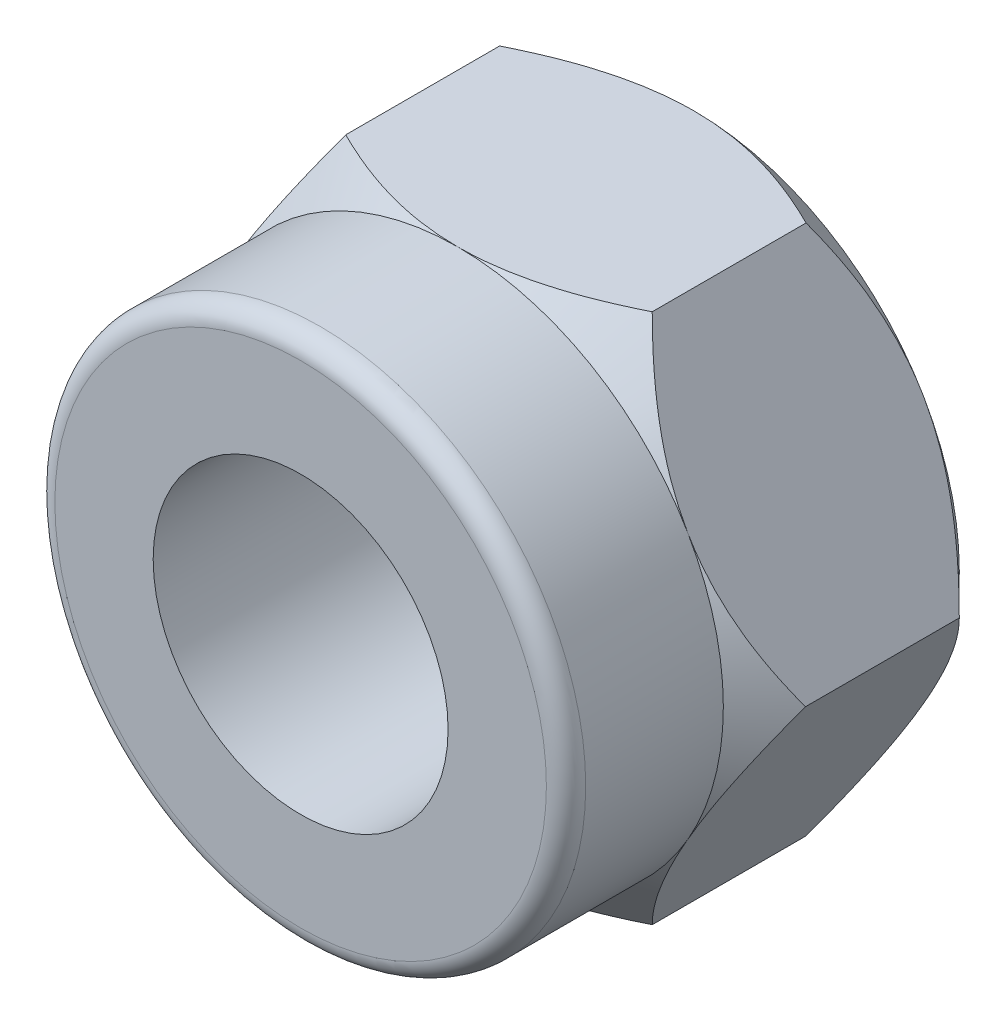
from build123d import *

# Parameters (mm, degrees)
EXTRUDE_1_DEPTH     = 2.4
SKETCH_2_OUTSIDE_W  = 17.954
SKETCH_2_OUTSIDE_H  = 17.118
SKETCH_2_OUTSIDE_R  = 2.7
CUT_EXTRUDE_1_DEPTH = 4
CUT_EXTRUDE_1_DRAFT = -45
SKETCH_3_OUTSIDE_W  = 17.954
SKETCH_3_OUTSIDE_H  = 17.118
SKETCH_3_OUTSIDE_R  = 2.7
CUT_EXTRUDE_2_DEPTH = 4
CUT_EXTRUDE_2_DRAFT = -45
SKETCH_3_2_R        = 2.7
EXTRUDE_2_DEPTH     = 1.6
FILLET_1_R          = 0.2
SKETCH_4_R          = 1.5
CUT_EXTRUDE_3_DEPTH = 6.745432969


with BuildPart() as part:
    # 草图1 → 凸台-拉伸1 (new body)
    with BuildSketch(Plane.XY):
        Polygon((-1.558845727, 2.7), (1.558845727, 2.7), (3.117691454, 0), (1.558845727, -2.7), (-1.558845727, -2.7), (-3.117691454, 0), align=None)
    extrude(amount=EXTRUDE_1_DEPTH)


with BuildPart() as cut_extrude_1_tool:
    # 草图2 outside → 切除-拉伸1 (with draft: the straight prism first)
    with BuildSketch(Plane(origin=(0, 0, 0), x_dir=(-1, 0, 0), z_dir=(0, 0, -1))):
        Rectangle(SKETCH_2_OUTSIDE_W, SKETCH_2_OUTSIDE_H)
        Circle(SKETCH_2_OUTSIDE_R, mode=Mode.SUBTRACT)
    extrude(amount=-CUT_EXTRUDE_1_DEPTH)
    # 切除-拉伸1: the draft: its side faces are tilted about the plane it starts from
    cut_extrude_1_sides = [cut_extrude_1_tool.faces().sort_by_distance(p)[0] for p in [
        (0, -8.559, 2),
        (-8.977, 0, 2),
        (0, 8.559, 2),
        (8.977, 0, 2),
        (2.7, 0, 2),
    ]]
    draft(cut_extrude_1_sides, Plane(origin=(0, 0, 0), x_dir=(-1, 0, 0), z_dir=(0, 0, -1)), CUT_EXTRUDE_1_DRAFT)


with BuildPart() as part_1:
    add(part.part)

    # 切除-拉伸1: cut by cut_extrude_1_tool
    add(cut_extrude_1_tool.part, mode=Mode.SUBTRACT)


with BuildPart() as cut_extrude_2_tool:
    # 草图3 outside → 切除-拉伸2 (with draft: the straight prism first)
    with BuildSketch(Plane.XY.offset(2.4)):
        Rectangle(SKETCH_3_OUTSIDE_W, SKETCH_3_OUTSIDE_H)
        Circle(SKETCH_3_OUTSIDE_R, mode=Mode.SUBTRACT)
    extrude(amount=-CUT_EXTRUDE_2_DEPTH)
    # 切除-拉伸2: the draft: its side faces are tilted about the plane it starts from
    cut_extrude_2_sides = [cut_extrude_2_tool.faces().sort_by_distance(p)[0] for p in [
        (0, -8.559, 0.4),
        (8.977, 0, 0.4),
        (0, 8.559, 0.4),
        (-8.977, 0, 0.4),
        (-2.7, 0, 0.4),
    ]]
    draft(cut_extrude_2_sides, Plane.XY.offset(2.4), CUT_EXTRUDE_2_DRAFT)


with BuildPart() as part_2:
    add(part_1.part)

    # 切除-拉伸2: cut by cut_extrude_2_tool
    add(cut_extrude_2_tool.part, mode=Mode.SUBTRACT)

    # 草图3<2> → 凸台-拉伸2 (add)
    with BuildSketch(Plane.XY.offset(2.4)):
        Circle(SKETCH_3_2_R)
    extrude(amount=EXTRUDE_2_DEPTH)

    # 圆角1
    fillet_1_edges = [part_2.edges().sort_by_distance(p)[0] for p in [
        (-2.7, 0, 4),
    ]]
    fillet(fillet_1_edges, radius=FILLET_1_R)

    # 草图4 → 切除-拉伸3 (cut, through all)
    with BuildSketch(Plane.XY.offset(4)):
        Circle(SKETCH_4_R)
    extrude(amount=-CUT_EXTRUDE_3_DEPTH, mode=Mode.SUBTRACT)


solid = part_2.part
